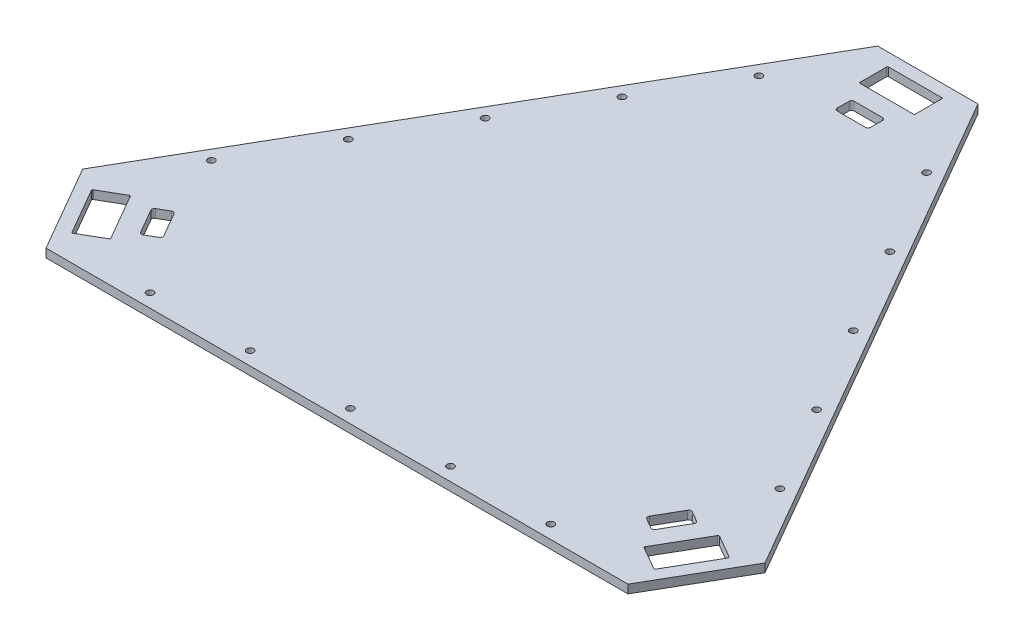
from build123d import *

# Parameters (mm, degrees)
SKETCH1_R           = 150.5
BOSS_EXTRUDE1_DEPTH = 6.35
SKETCH3_R           = 2.6
CUT_EXTRUDE2_DEPTH  = 10
CUT_EXTRUDE3_DEPTH  = 10


with BuildPart() as part:
    # Sketch1 → Boss-Extrude1 (new body)
    # profile 1 of 2: a face of its own
    with BuildSketch(Plane(origin=(-388.281715987, 0, -288.185661777), x_dir=(1, 0, 0), z_dir=(0, 1, 0))):
        Polygon((1927.853460271, -13527.084883536), (1965.381699324, -13462.084066777), (1747.570833697, -13084.824581071), (1672.514355591, -13084.824581071), (1454.703489965, -13462.084066777), (1492.231729019, -13527.084883536), align=None)
        with Locations((1710.042594644, -13357.997843795)):
            Circle(SKETCH1_R, mode=Mode.SUBTRACT)
        with BuildLine():
            ThreePointArc((1909.99400131, -13496.418380494), (1909.919076, -13496.98749472), (1910.268520339, -13497.442899434))
            Line((1910.268520339, -13497.442899434), (1927.415821483, -13507.342898365))
            ThreePointArc((1927.415821483, -13507.342898365), (1927.984935702, -13507.417823673), (1928.440340423, -13507.068379346))
            Line((1928.440340423, -13507.068379346), (1948.340338275, -13472.600571997))
            ThreePointArc((1948.340338275, -13472.600571997), (1948.415263583, -13472.031457775), (1948.065819252, -13471.576053055))
            Line((1948.065819252, -13471.576053055), (1930.918518105, -13461.676054122))
            ThreePointArc((1930.918518105, -13461.676054122), (1930.349403886, -13461.601128813), (1929.893999164, -13461.95057314))
            Line((1929.893999164, -13461.95057314), (1909.99400131, -13496.418380494))
        make_face(mode=Mode.SUBTRACT)
        with BuildLine():
            ThreePointArc((1472.019370034, -13471.57605305), (1471.669925699, -13472.031457773), (1471.744851013, -13472.600571998))
            Line((1471.744851013, -13472.600571998), (1491.644848864, -13507.068379347))
            ThreePointArc((1491.644848864, -13507.068379347), (1492.100253585, -13507.41782368), (1492.669367808, -13507.342898369))
            Line((1492.669367808, -13507.342898369), (1509.816668952, -13497.442899438))
            ThreePointArc((1509.816668952, -13497.442899438), (1510.166113284, -13496.987494718), (1510.091187977, -13496.418380495))
            Line((1510.091187977, -13496.418380495), (1490.191190123, -13461.950573141))
            ThreePointArc((1490.191190123, -13461.950573141), (1489.735785404, -13461.60112881), (1489.166671181, -13461.676054117))
            Line((1489.166671181, -13461.676054117), (1472.019370034, -13471.57605305))
        make_face(mode=Mode.SUBTRACT)
        with BuildLine():
            ThreePointArc((1689.392596873, -13114.874577827), (1689.612266763, -13115.404907856), (1690.142596792, -13115.62457775))
            Line((1690.142596792, -13115.62457775), (1729.942592497, -13115.62457775))
            ThreePointArc((1729.942592497, -13115.62457775), (1730.472922528, -13115.404907859), (1730.692592416, -13114.874577827))
            Line((1730.692592416, -13114.874577827), (1730.692592416, -13095.074579966))
            ThreePointArc((1730.692592416, -13095.074579966), (1730.472922526, -13094.544249938), (1729.942592497, -13094.324580043))
            Line((1729.942592497, -13094.324580043), (1690.142596792, -13094.324580043))
            ThreePointArc((1690.142596792, -13094.324580043), (1689.612266761, -13094.544249935), (1689.392596873, -13095.074579966))
            Line((1689.392596873, -13095.074579966), (1689.392596873, -13114.874577827))
        make_face(mode=Mode.SUBTRACT)
    # profile 2 of 2: a face of its own
    with BuildSketch(Plane(origin=(-388.281715987, 0, -288.185661777), x_dir=(1, 0, 0), z_dir=(0, 1, 0))):
        with Locations((1710.042594644, -13357.997843795)):
            Circle(SKETCH1_R)
    extrude(amount=BOSS_EXTRUDE1_DEPTH)

    # Sketch3 → Cut-Extrude2 (cut)
    with BuildSketch(Plane(origin=(0, 6.35, 0), x_dir=(1, 0, 0), z_dir=(0, 1, 0))):
        with Locations(Location((1183.987460829, -12990.268662147, 0), (0, 0, 270))):
            Circle(SKETCH3_R)
        with Locations(Location((1146.487460829, -13055.220567431, 0), (0, 0, 270))):
            Circle(SKETCH3_R)
        with Locations(Location((1108.987460829, -13120.172472715, 0), (0, 0, 270))):
            Circle(SKETCH3_R)
        with Locations(Location((1221.487460829, -12925.316756863, 0), (0, 0, 270))):
            Circle(SKETCH3_R)
        with Locations(Location((1258.987460829, -12860.364851579, 0), (0, 0, 270))):
            Circle(SKETCH3_R)
        with Locations(Location((1459.534296487, -12990.268662148, 0), (0, 0, 270))):
            Circle(SKETCH3_R)
        with Locations(Location((1497.034296487, -13055.220567432, 0), (0, 0, 270))):
            Circle(SKETCH3_R)
        with Locations(Location((1534.534296487, -13120.172472716, 0), (0, 0, 270))):
            Circle(SKETCH3_R)
        with Locations(Location((1422.034296487, -12925.316756864, 0), (0, 0, 270))):
            Circle(SKETCH3_R)
        with Locations(Location((1384.534296487, -12860.364851581, 0), (0, 0, 270))):
            Circle(SKETCH3_R)
        with Locations(Location((1321.760878657, -13228.899221759, 0), (0, 0, 270))):
            Circle(SKETCH3_R)
        with Locations(Location((1246.760878657, -13228.899221759, 0), (0, 0, 270))):
            Circle(SKETCH3_R)
        with Locations(Location((1171.760878657, -13228.899221759, 0), (0, 0, 270))):
            Circle(SKETCH3_R)
        with Locations(Location((1396.760878657, -13228.899221759, 0), (0, 0, 270))):
            Circle(SKETCH3_R)
        with Locations(Location((1471.760878657, -13228.899221759, 0), (0, 0, 270))):
            Circle(SKETCH3_R)
    extrude(amount=-CUT_EXTRUDE2_DEPTH, mode=Mode.SUBTRACT)

    # Sketch4 → Cut-Extrude3 (cut)
    with BuildSketch(Plane(origin=(0, 6.35, 0), x_dir=(1, 0, 0), z_dir=(0, 1, 0))):
        with BuildLine():
            Line((1118.560623635, -13175.005548302), (1129.060623635, -13193.192081781))
            ThreePointArc((1129.060623635, -13193.192081781), (1130.275036352, -13194.123933434), (1131.792674443, -13193.924132589))
            Line((1131.792674443, -13193.924132589), (1139.327095456, -13189.574132589))
            ThreePointArc((1139.327095456, -13189.574132589), (1140.258947108, -13188.359719871), (1140.059146263, -13186.842081781))
            Line((1140.059146263, -13186.842081781), (1129.559146263, -13168.655548302))
            ThreePointArc((1129.559146263, -13168.655548302), (1128.344733546, -13167.723696649), (1126.827095456, -13167.923497494))
            Line((1126.827095456, -13167.923497494), (1119.292674443, -13172.273497494))
            ThreePointArc((1119.292674443, -13172.273497494), (1118.36082279, -13173.487910212), (1118.560623635, -13175.005548302))
        make_face()
        with BuildLine():
            Line((1332.260878658, -12841.23891597), (1311.260878658, -12841.23891597))
            ThreePointArc((1311.260878658, -12841.23891597), (1309.846665095, -12841.824702408), (1309.260878658, -12843.23891597))
            Line((1309.260878658, -12843.23891597), (1309.260878658, -12851.93891597))
            ThreePointArc((1309.260878658, -12851.93891597), (1309.846665095, -12853.353129533), (1311.260878658, -12853.93891597))
            Line((1311.260878658, -12853.93891597), (1332.260878658, -12853.93891597))
            ThreePointArc((1332.260878658, -12853.93891597), (1333.67509222, -12853.353129533), (1334.260878658, -12851.93891597))
            Line((1334.260878658, -12851.93891597), (1334.260878658, -12843.23891597))
            ThreePointArc((1334.260878658, -12843.23891597), (1333.67509222, -12841.824702408), (1332.260878658, -12841.23891597))
        make_face()
        with BuildLine():
            Line((1514.461133681, -13193.192081781), (1524.961133681, -13175.005548301))
            ThreePointArc((1524.961133681, -13175.005548301), (1525.160934526, -13173.487910211), (1524.229082873, -13172.273497494))
            Line((1524.229082873, -13172.273497494), (1516.69466186, -13167.923497494))
            ThreePointArc((1516.69466186, -13167.923497494), (1515.17702377, -13167.723696649), (1513.962611053, -13168.655548301))
            Line((1513.962611053, -13168.655548301), (1503.462611053, -13186.842081781))
            ThreePointArc((1503.462611053, -13186.842081781), (1503.262810208, -13188.359719871), (1504.19466186, -13189.574132588))
            Line((1504.19466186, -13189.574132588), (1511.729082873, -13193.924132588))
            ThreePointArc((1511.729082873, -13193.924132588), (1513.246720964, -13194.123933434), (1514.461133681, -13193.192081781))
        make_face()
    extrude(amount=-CUT_EXTRUDE3_DEPTH, mode=Mode.SUBTRACT)


solid = part.part
